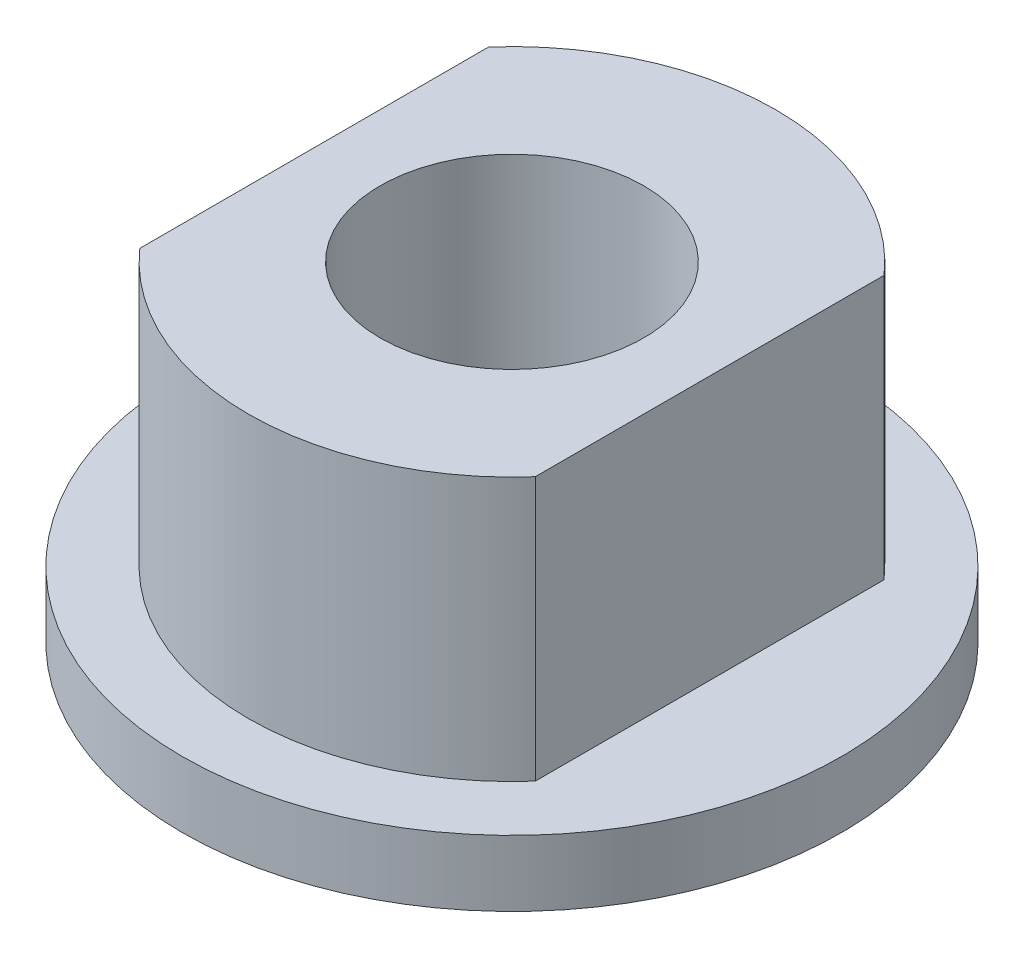
from build123d import *

# Parameters (mm, degrees)
CROQUIS1_R              = 12.5
SALIENTE_EXTRUIR1_DEPTH = 2.5
SALIENTE_EXTRUIR2_DEPTH = 10
CROQUIS3_R              = 5
CORTAR_EXTRUIR1_DEPTH   = 22.650635095


with BuildPart() as part:
    # Croquis1 → Saliente-Extruir1 (new body)
    with BuildSketch(Plane(origin=(0, 0, 0), x_dir=(1, 0, 0), z_dir=(0, 1, 0))):
        with Locations(Location((0, 0, 0), (0, 0, 270))):
            Circle(CROQUIS1_R)
    extrude(amount=SALIENTE_EXTRUIR1_DEPTH)

    # Croquis2 → Saliente-Extruir2 (add)
    with BuildSketch(Plane(origin=(0, 2.5, 0), x_dir=(1, 0, 0), z_dir=(0, 1, 0))):
        with BuildLine():
            Line((-7.5, 6.614378278), (-7.5, -6.614378278))
            ThreePointArc((-7.5, -6.614378278), (0, -10), (7.5, -6.614378278))
            Line((7.5, -6.614378278), (7.5, 6.614378278))
            ThreePointArc((7.5, 6.614378278), (0, 10), (-7.5, 6.614378278))
        make_face()
    extrude(amount=SALIENTE_EXTRUIR2_DEPTH)

    # Croquis3 → Cortar-Extruir1 (cut, through all)
    with BuildSketch(Plane(origin=(0, 12.5, 0), x_dir=(1, 0, 0), z_dir=(0, 1, 0))):
        with Locations(Location((0, 0, 0), (0, 0, 270))):
            Circle(CROQUIS3_R)
    extrude(amount=-CORTAR_EXTRUIR1_DEPTH, mode=Mode.SUBTRACT)


solid = part.part
